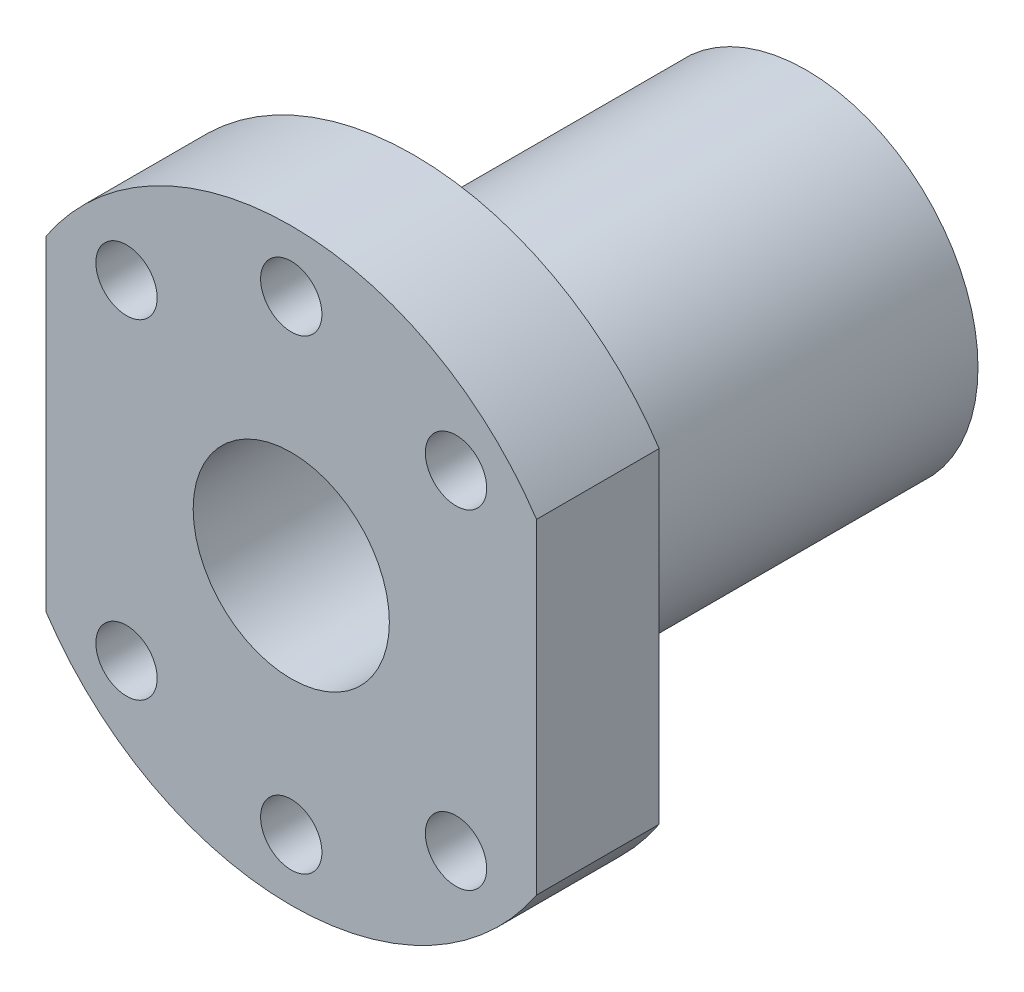
from build123d import *

# Parameters (mm, degrees)
BOSS_EXTRUDE1_DEPTH   = 10
SKETCH2_R             = 14
BOSS_EXTRUDE2_DEPTH   = 32
SKETCH3_R             = 8
CUT_EXTRUDE1_DEPTH    = 53.345009313
F_5_0MM_DOWEL_HOLE1_D = 5
CIRPATTERN1_COUNT     = 8


with BuildPart() as part:
    # Sketch1 → Boss-Extrude1 (new body)
    with BuildSketch(Plane.XY):
        with BuildLine():
            Line((-20, 13.266499161), (-20, -13.266499161))
            ThreePointArc((-20, -13.266499161), (0, -24), (20, -13.266499161))
            Line((20, -13.266499161), (20, 13.266499161))
            ThreePointArc((20, 13.266499161), (0, 24), (-20, 13.266499161))
        make_face()
    extrude(amount=BOSS_EXTRUDE1_DEPTH)

    # Sketch2 → Boss-Extrude2 (add)
    with BuildSketch(Plane(origin=(0, 0, 0), x_dir=(-1, 0, 0), z_dir=(0, 0, -1))):
        with Locations(Location((0, 0, 0), (0, 0, 180))):
            Circle(SKETCH2_R)
    extrude(amount=BOSS_EXTRUDE2_DEPTH)

    # Sketch3 → Cut-Extrude1 (cut, through all)
    with BuildSketch(Plane(origin=(0, 0, -32), x_dir=(-1, 0, 0), z_dir=(0, 0, -1))):
        Circle(SKETCH3_R)
    extrude(amount=-CUT_EXTRUDE1_DEPTH, mode=Mode.SUBTRACT)

    # Ø5.0mm Dowel Hole1 (through all)
    with Locations(Plane.XY.offset(10)):
        with Locations((0, 19)):
            f_5_0mm_dowel_hole1 = Hole(F_5_0MM_DOWEL_HOLE1_D / 2)

    # CirPattern1: Ø5.0mm Dowel Hole1 ×8 about axis, 2 skipped
    cirpattern1_axis = Axis((0, 0, 0), (0, 0, -1))
    add([f_5_0mm_dowel_hole1.rotate(cirpattern1_axis, i * 360 / CIRPATTERN1_COUNT) for i in range(1, CIRPATTERN1_COUNT) if i not in (2, 6)], mode=Mode.SUBTRACT)


solid = part.part
